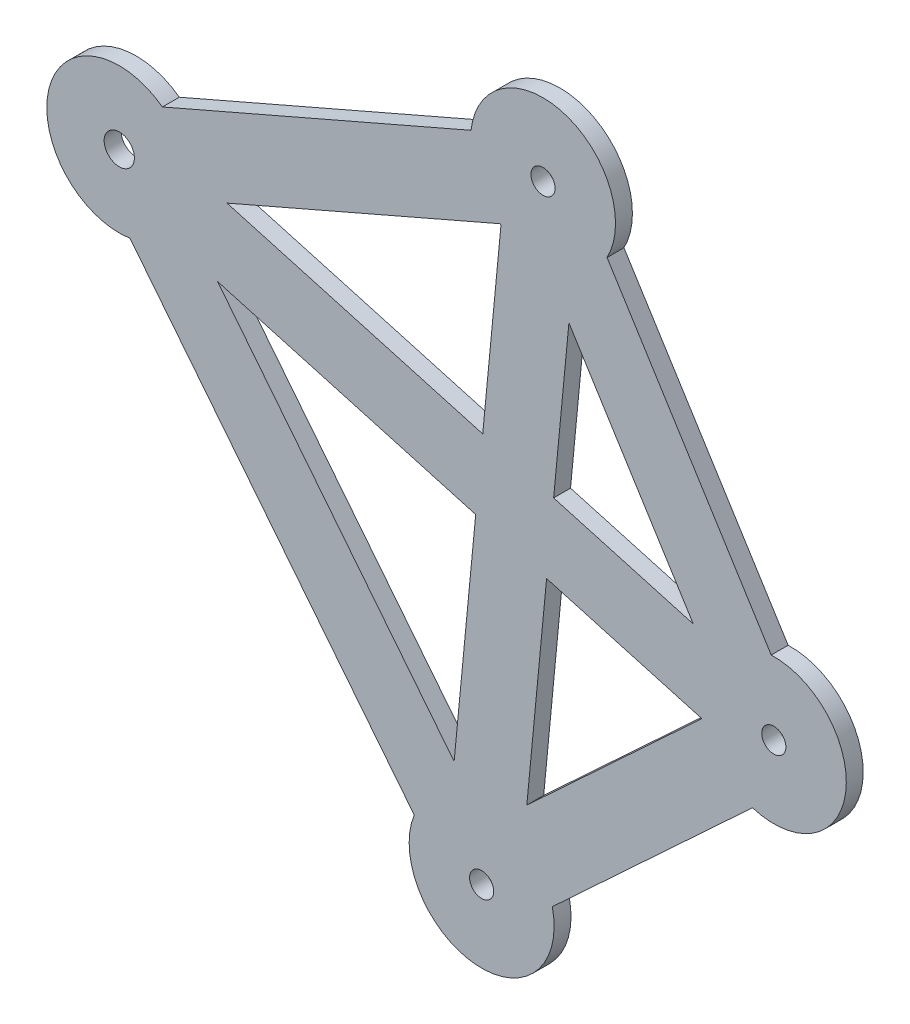
from build123d import *

# Parameters (mm, degrees)
SKETCH2_W           = 457.2
SKETCH2_H           = 457.2
BOSS_EXTRUDE3_DEPTH = 4.445
SKETCH3_R           = 3.175
SKETCH3_R_2         = 3.9751
CUT_EXTRUDE1_DEPTH  = 324.31977673
SKETCH4_W           = 457.2
SKETCH4_H           = 457.2
SKETCH4_R           = 3.175
CUT_EXTRUDE2_DEPTH  = 324.31977673


with BuildPart() as part:
    # Sketch2 → Boss-Extrude3 (new body)
    with BuildSketch(Plane.XY):
        Rectangle(SKETCH2_W, SKETCH2_H)
    extrude(amount=BOSS_EXTRUDE3_DEPTH)

    # Sketch3 → Cut-Extrude1 (cut, through all)
    with BuildSketch(Plane(origin=(0, 0, 0), x_dir=(-1, 0, 0), z_dir=(0, 0, -1))):
        with Locations((-138.143199548, 71.871365193)):
            Circle(SKETCH3_R)
        with Locations((-198.809547248, -25.000118004)):
            Circle(SKETCH3_R)
        with Locations((-122.004659563, -96.265887155)):
            Circle(SKETCH3_R)
        with Locations((-26.754659563, -96.265887155)):
            Circle(SKETCH3_R)
        with Locations((-26.754659563, 23.469712845)):
            Circle(SKETCH3_R_2)
    extrude(amount=-CUT_EXTRUDE1_DEPTH, mode=Mode.SUBTRACT)

    # Sketch4 → Cut-Extrude2 (cut, through all)
    # profile 1 of 5: a face of its own
    with BuildSketch(Plane.XY.offset(4.445)):
        Rectangle(SKETCH4_W, SKETCH4_H)
        with Locations((26.754659563, -96.265887155)):
            Circle(SKETCH4_R, mode=Mode.SUBTRACT)
        with BuildLine():
            Line((104.279919091, -89.284764381), (29.57120013, 4.629075933))
            ThreePointArc((29.57120013, 4.629075933), (8.270979184, 28.080142289), (38.089671454, 38.780493538))
            Line((38.089671454, 38.780493538), (119.216168571, 74.032383096))
            ThreePointArc((119.216168571, 74.032383096), (139.225456422, 90.890598092), (157.193199548, 71.871365193))
            ThreePointArc((157.193199548, 71.871365193), (156.629627395, 67.271964637), (154.972256192, 62.944699943))
            Line((154.972256192, 62.944699943), (198.125737804, -5.962394804))
            ThreePointArc((198.125737804, -5.962394804), (212.035958895, -11.290102141), (217.859547248, -25.000118004))
            ThreePointArc((217.859547248, -25.000118004), (210.121888692, -40.327656327), (193.194620104, -43.203828976))
            Line((193.194620104, -43.203828976), (140.576999281, -92.026701216))
            ThreePointArc((140.576999281, -92.026701216), (140.934867851, -94.13288125), (141.054659563, -96.265887155))
            ThreePointArc((141.054659563, -96.265887155), (118.451759762, -114.981639959), (104.279919091, -89.284764381))
        make_face(mode=Mode.SUBTRACT)
    # profile 2 of 5: a face of its own
    with BuildSketch(Plane.XY.offset(4.445)):
        with BuildLine():
            ThreePointArc((127.085491453, 56.359125133), (126.946386449, 56.459231128), (126.808187657, 56.5605845))
            Line((126.808187657, 56.5605845), (55.070704112, 25.388502171))
            Line((55.070704112, 25.388502171), (122.29505865, 6.450632186))
            Line((122.29505865, 6.450632186), (127.085491453, 56.359125133))
        make_face()
    # profile 3 of 5: a face of its own
    with BuildSketch(Plane.XY.offset(4.445)):
        Polygon((144.946705866, 43.06176458), (140.928758156, 1.201305791), (177.638536292, -9.140258814), align=None)
    # profile 4 of 5: a face of its own
    with BuildSketch(Plane.XY.offset(4.445)):
        Polygon((179.886249099, -29.564951481), (139.079100318, -18.069110674), (133.87810257, -72.255020413), align=None)
    # profile 5 of 5: a face of its own
    with BuildSketch(Plane.XY.offset(4.445)):
        Polygon((120.445400812, -12.81978428), (52.587094953, 6.296677047), (114.776579601, -71.879651121), align=None)
    extrude(amount=-CUT_EXTRUDE2_DEPTH, mode=Mode.SUBTRACT)


solid = part.part
